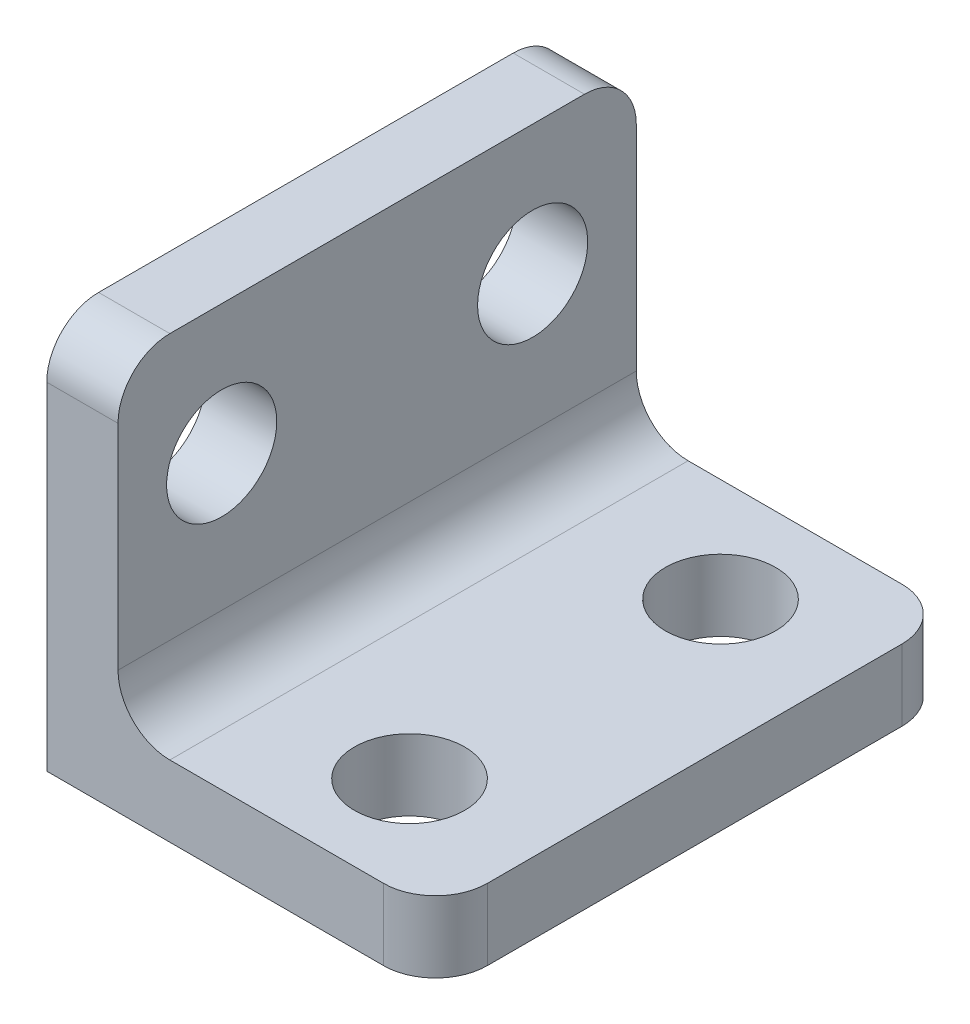
from build123d import *

# Parameters (mm, degrees)
SKETCH3_W           = 15
SKETCH3_H           = 20
SKETCH3_R           = 2.125
BOSS_EXTRUDE3_DEPTH = 2.75
SKETCH5_W           = 20
SKETCH5_H           = 15
SKETCH5_R           = 2.125
BOSS_EXTRUDE5_DEPTH = 2.75
FILLET4_R           = 2


with BuildPart() as part:
    # Sketch3 → Boss-Extrude3 (new body)
    with BuildSketch(Plane(origin=(0, 0, 0), x_dir=(1, 0, 0), z_dir=(0, 1, 0))):
        with Locations((7.5, 0)):
            Rectangle(SKETCH3_W, SKETCH3_H)
        with Locations(Location((10, 6, 0), (0, 0, 270))):
            Circle(SKETCH3_R, mode=Mode.SUBTRACT)
        with Locations(Location((10, -6, 0), (0, 0, 90))):
            Circle(SKETCH3_R, mode=Mode.SUBTRACT)
    extrude(amount=BOSS_EXTRUDE3_DEPTH)

    # Sketch5 → Boss-Extrude5 (add)
    with BuildSketch(Plane.ZY):
        with Locations((0, 7.5)):
            Rectangle(SKETCH5_W, SKETCH5_H)
        with Locations((-6, 10)):
            Circle(SKETCH5_R, mode=Mode.SUBTRACT)
        with Locations(Location((6, 10, 0), (0, 0, 180))):
            Circle(SKETCH5_R, mode=Mode.SUBTRACT)
    extrude(amount=-BOSS_EXTRUDE5_DEPTH)

    # Fillet4
    fillet4_edges = [part.edges().sort_by_distance(p)[0] for p in [
        (1.375, 15, 10),
        (1.375, 15, -10),
        (2.75, 2.75, 0),
        (15, 1.375, 10),
        (15, 1.375, -10),
    ]]
    fillet(fillet4_edges, radius=FILLET4_R)


solid = part.part
